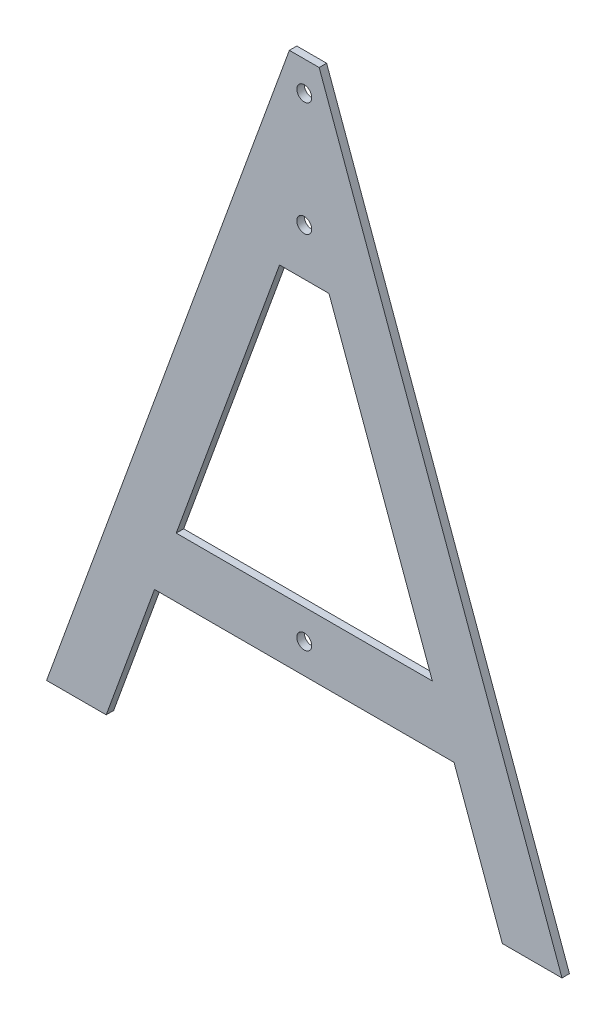
from build123d import *

# Parameters (mm, degrees)
SKETCH1_R           = 3.175
BOSS_EXTRUDE1_DEPTH = 3.175


with BuildPart() as part:
    # Sketch1 → Boss-Extrude1 (new body)
    with BuildSketch(Plane.XY):
        Polygon((6.35, 12.7), (-6.35, 12.7), (-109.769758062, -271.44345), (-84.369758062, -271.44345), (-63.785953331, -214.889911296), (63.785953331, -214.889911296), (84.369758062, -271.44345), (109.769758062, -271.44345), align=None)
        Circle(SKETCH1_R, mode=Mode.SUBTRACT)
        with Locations((0, -48.55845)):
            Circle(SKETCH1_R, mode=Mode.SUBTRACT)
        with Locations((0, -202.189911296)):
            Circle(SKETCH1_R, mode=Mode.SUBTRACT)
        Polygon((54.541109381, -189.489911296), (10.527609118, -68.563813172), (-10.527609118, -68.563813172), (-54.541109381, -189.489911296), align=None, mode=Mode.SUBTRACT)
    extrude(amount=BOSS_EXTRUDE1_DEPTH)


solid = part.part
